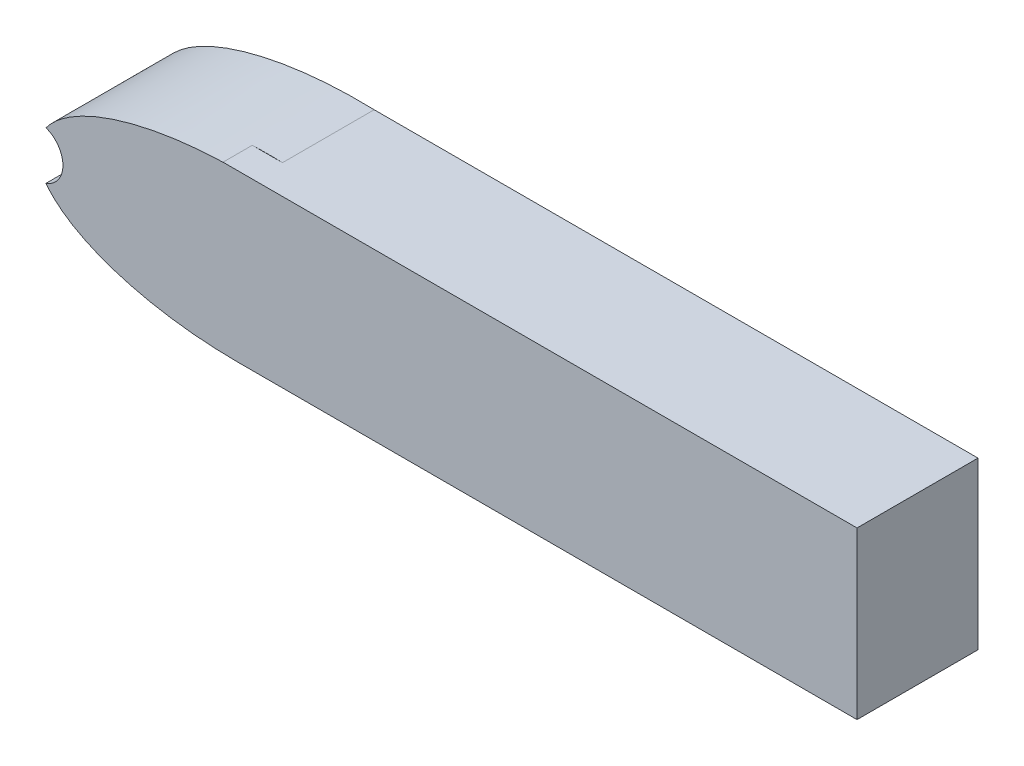
from build123d import *

# Parameters (mm, degrees)
SKETCH1_RX          = 40.067331288
SKETCH1_RY          = 16.556748466
BOSS_EXTRUDE1_DEPTH = 18.288
BOSS_EXTRUDE2_DEPTH = 24.13
SKETCH4_R           = 5.089278313
CUT_EXTRUDE1_DEPTH  = 49.784


with BuildPart() as part:
    # Sketch1 → Boss-Extrude1 (new body)
    with BuildSketch(Plane.XY):
        with Locations(Location((-74.44297323, -2.317944785), (0, 0, 180))):
            Ellipse(SKETCH1_RX, SKETCH1_RY)
    extrude(amount=BOSS_EXTRUDE1_DEPTH)

    # Sketch3 → Boss-Extrude2 (add)
    with BuildSketch(Plane(origin=(0, 0, 0), x_dir=(-1, 0, 0), z_dir=(0, 0, -1))):
        with BuildLine():
            Line((74.44297323, -18.874693252), (-48.961371747, -18.874693252))
            Line((-48.961371747, -18.874693252), (-48.961371747, 14.238803681))
            Line((-48.961371747, 14.238803681), (77.490698265, 14.190836373))
            add(Edge.make_bspline(
                [(74.44297323, -18.874693252), (113.013283161, -18.874693252), (114.48127378, -2.948096616), (115.949264398, 12.978500019), (77.490698265, 14.190836373)],
                knots=[4.71238898, 4.71238898, 4.71238898, 6.245115993, 6.245115993, 7.777843005, 7.777843005, 7.777843005], degree=2, weights=[1, 0.720437409, 1, 0.720437409, 1]))
        make_face()
    extrude(amount=-BOSS_EXTRUDE2_DEPTH)

    # Sketch4 → Cut-Extrude1 (cut)
    with BuildSketch(Plane(origin=(0, 0, 0), x_dir=(-1, 0, 0), z_dir=(0, 0, -1))):
        with Locations((114.510304518, -2.317944785)):
            Circle(SKETCH4_R)
    extrude(amount=-CUT_EXTRUDE1_DEPTH, mode=Mode.SUBTRACT)


solid = part.part
